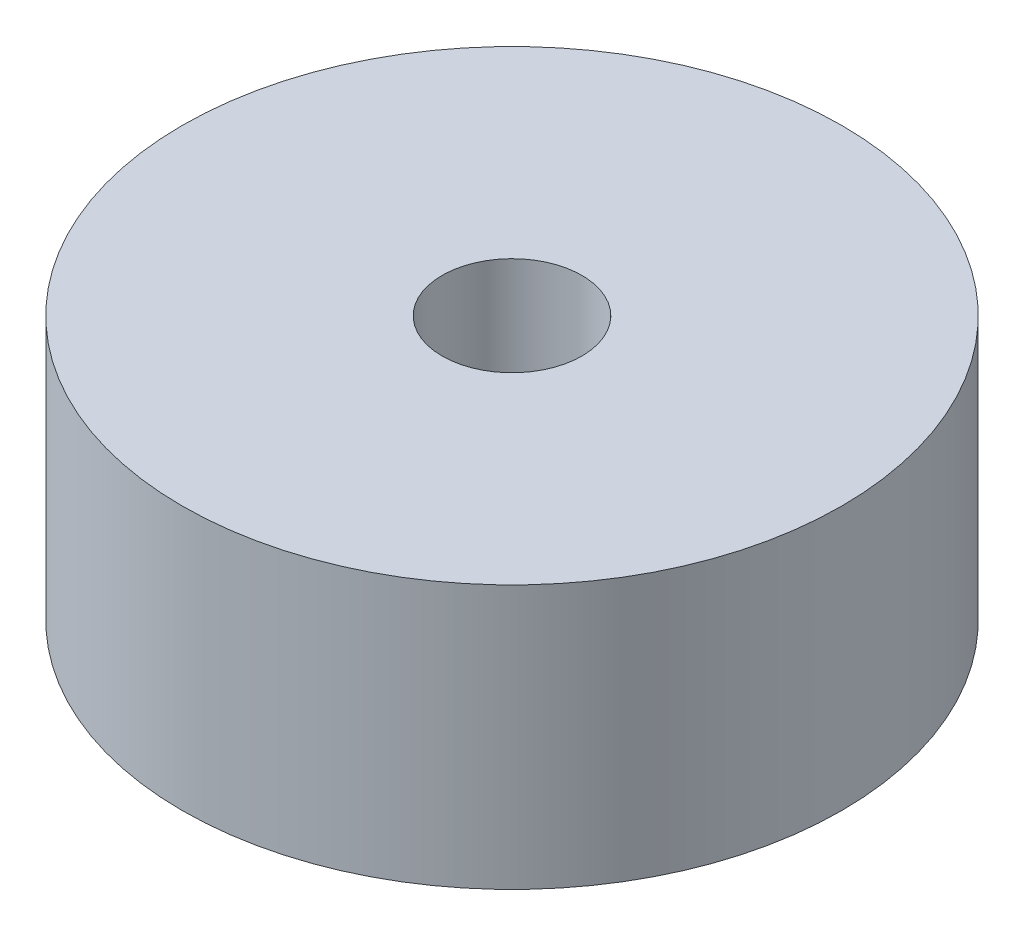
from build123d import *

# Parameters (mm, degrees)
SKETCH1_R            = 9.525
STOCK_DEPTH          = 7.62
ALIGNMENT_PIN_HOLE_D = 4.0386


with BuildPart() as part:
    # Sketch1 → Stock (new body)
    with BuildSketch(Plane(origin=(0, 0, 0), x_dir=(1, 0, 0), z_dir=(0, 1, 0))):
        with Locations(Location((0, 0, 0), (0, 0, 90))):
            Circle(SKETCH1_R)
    extrude(amount=STOCK_DEPTH)

    # Alignment Pin Hole (through all)
    with Locations(Plane(origin=(0, 7.62, 0), x_dir=(1, 0, 0), z_dir=(0, 1, 0))):
        with Locations((0, 0)):
            Hole(ALIGNMENT_PIN_HOLE_D / 2)


solid = part.part
